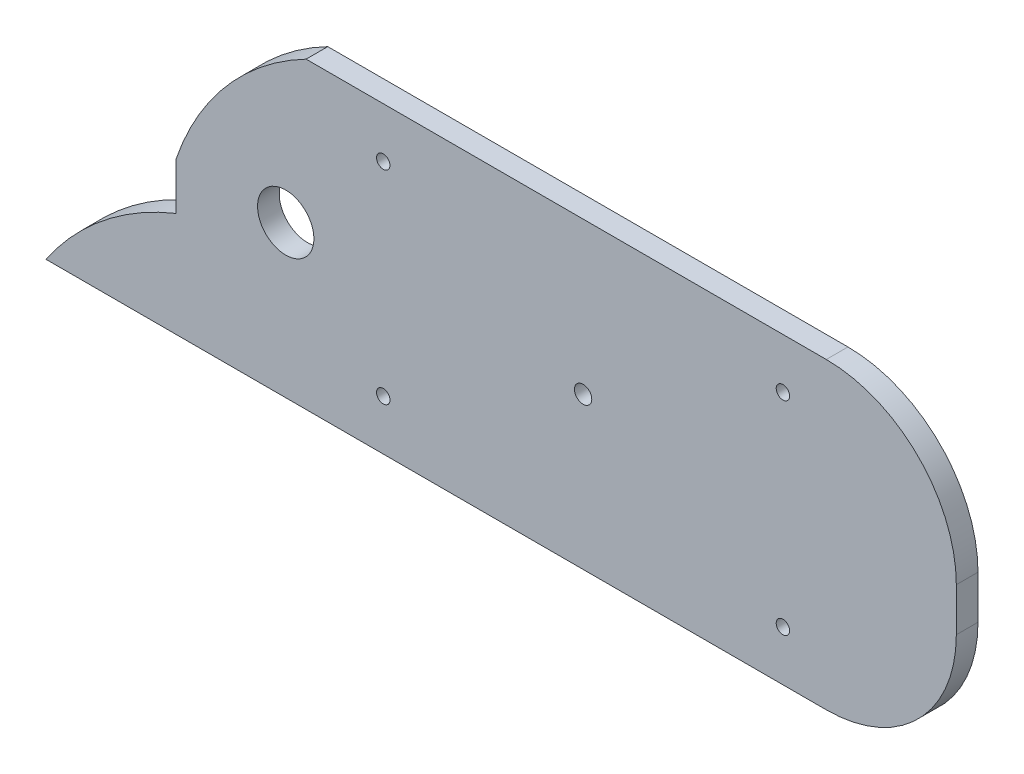
from build123d import *

# Parameters (mm, degrees)
BOSS_EXTRUDE1_DEPTH = 12.7
SKETCH4_R           = 5.08
SKETCH4_R_2         = 3.937
SKETCH4_R_3         = 16.51
CUT_EXTRUDE2_DEPTH  = 563.396381567


with BuildPart() as part:
    # Sketch2 → Boss-Extrude1 (new body)
    with BuildSketch(Plane.XY):
        with BuildLine():
            Line((0, 0), (457.2, 0))
            ThreePointArc((457.2, 0), (511.081536726, 22.318463274), (533.4, 76.2))
            Line((533.4, 76.2), (533.4, 101.6))
            ThreePointArc((533.4, 101.6), (511.081536726, 155.481536726), (457.2, 177.8))
            Line((457.2, 177.8), (152.4, 177.8))
            ThreePointArc((152.4, 177.8), (105.657968509, 140.757455564), (76.2, 88.9))
            Line((76.2, 88.9), (76.2, 61.401251199))
            ThreePointArc((76.2, 61.401251199), (33.506060073, 36.401783403), (0, 0))
        make_face()
    extrude(amount=BOSS_EXTRUDE1_DEPTH)

    # Sketch4 → Cut-Extrude2 (cut, through all)
    with BuildSketch(Plane.XY.offset(12.7)):
        with Locations((314.706, 88.9)):
            Circle(SKETCH4_R)
        with Locations((431.8, 148.4376)):
            Circle(SKETCH4_R_2)
        with Locations((140.468339853, 88.9)):
            Circle(SKETCH4_R_3)
        with Locations(Location((197.612, 148.4376, 0), (0, 0, 180))):
            Circle(SKETCH4_R_2)
        with Locations((197.612, 29.3624)):
            Circle(SKETCH4_R_2)
        with Locations(Location((431.8, 29.3624, 0), (0, 0, 180))):
            Circle(SKETCH4_R_2)
    extrude(amount=-CUT_EXTRUDE2_DEPTH, mode=Mode.SUBTRACT)


solid = part.part
